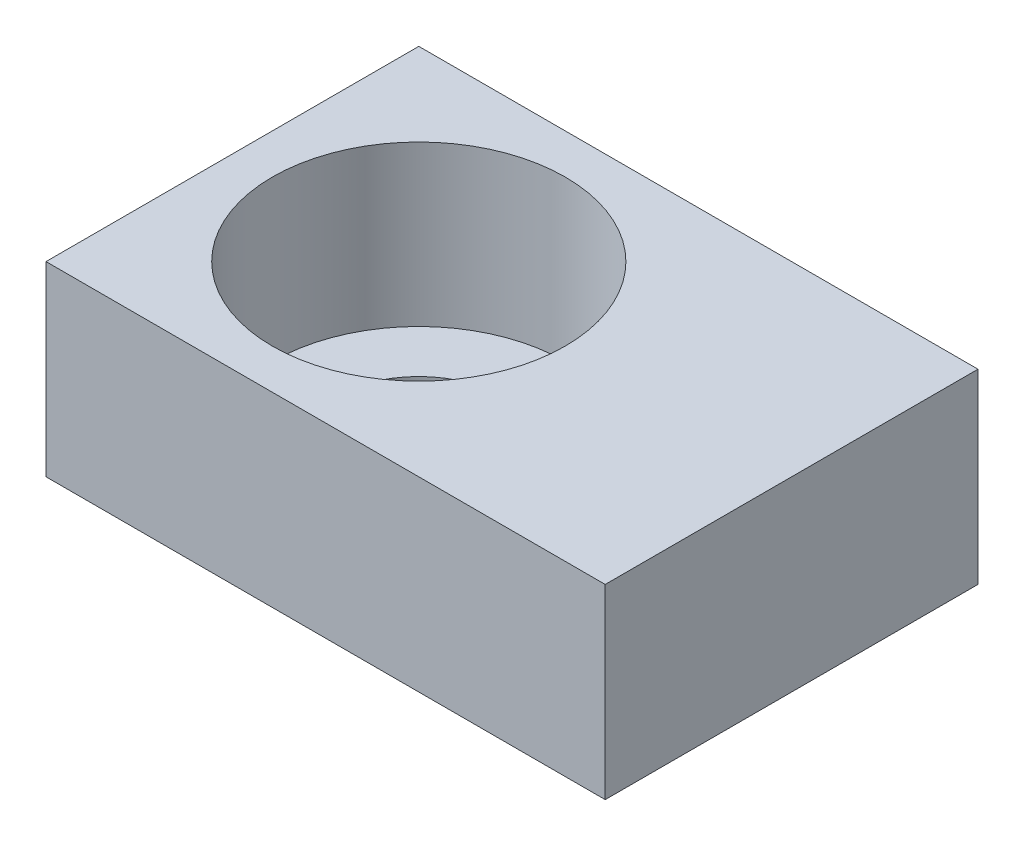
from build123d import *

# Parameters (mm, degrees)
SALIENTE_EXTRUIR1_DEPTH = 7
CROQUIS2_R              = 1.6
CORTAR_EXTRUIR1_DEPTH   = 6
CROQUIS3_R              = 2.75
CORTAR_EXTRUIR2_DEPTH   = 3


with BuildPart() as part:
    # Croquis1 → Saliente-Extruir1 (new body)
    with BuildSketch(Plane.XY):
        Polygon((0, 0), (7, 0), (10.5, 0), (10.5, 3.5), (0, 3.5), align=None)
    extrude(amount=SALIENTE_EXTRUIR1_DEPTH)

    # Croquis2 → Cortar-Extruir1 (cut)
    with BuildSketch(Plane.XZ):
        with Locations(Location((3.5, 3.5, 0), (0, 0, 270))):
            Circle(CROQUIS2_R)
    extrude(amount=-CORTAR_EXTRUIR1_DEPTH, mode=Mode.SUBTRACT)

    # Croquis3 → Cortar-Extruir2 (cut)
    with BuildSketch(Plane(origin=(0, 3.5, 0), x_dir=(1, 0, 0), z_dir=(0, 1, 0))):
        with Locations(Location((3.5, -3.5, 0), (0, 0, 180))):
            Circle(CROQUIS3_R)
    extrude(amount=-CORTAR_EXTRUIR2_DEPTH, mode=Mode.SUBTRACT)


solid = part.part
